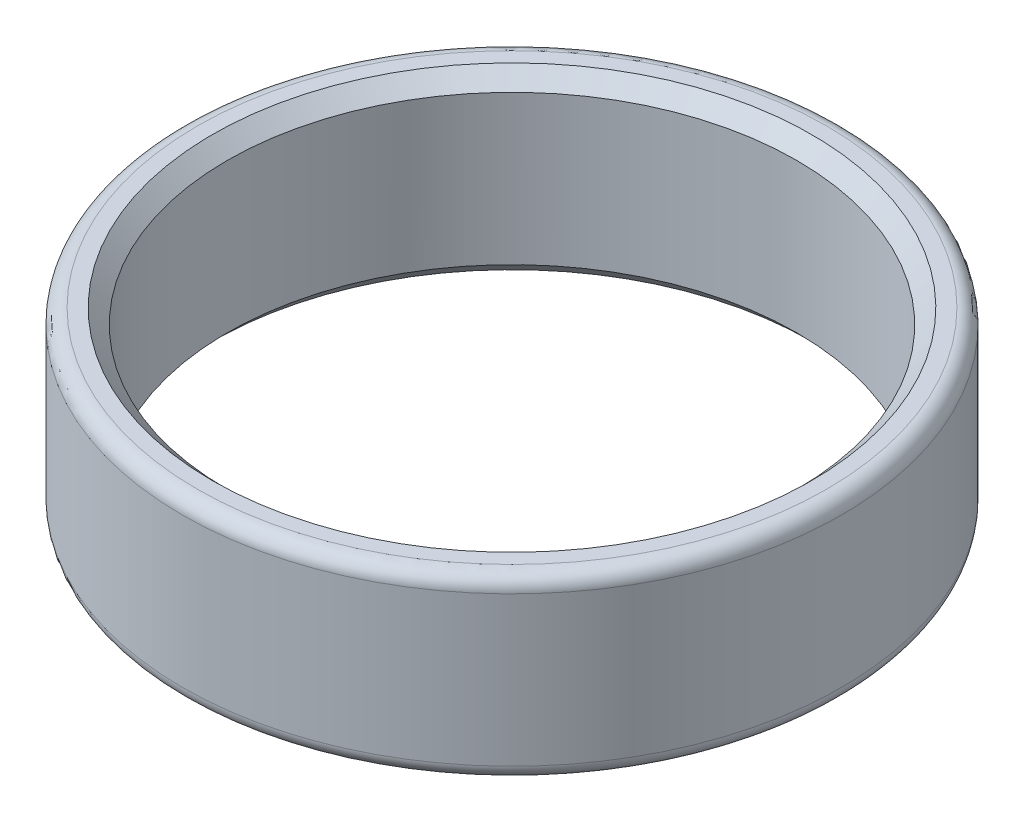
from build123d import *

# Parameters (mm, degrees)
SKETCH1_R           = 35.052
SKETCH1_R_2         = 30.2895
BOSS_EXTRUDE1_DEPTH = 19.05
FILLET1_R           = 1.5875
CHAMFER1_SIZE       = 1.5875


with BuildPart() as part:
    # Sketch1 → Boss-Extrude1 (new body)
    with BuildSketch(Plane(origin=(0, 0, 0), x_dir=(1, 0, 0), z_dir=(0, 1, 0))):
        with Locations(Location((0, 0, 0), (0, 0, 90))):
            Circle(SKETCH1_R)
        with Locations(Location((0, 0, 0), (0, 0, 90))):
            Circle(SKETCH1_R_2, mode=Mode.SUBTRACT)
    extrude(amount=BOSS_EXTRUDE1_DEPTH)

    # Fillet1
    fillet1_edges = [part.edges().sort_by_distance(p)[0] for p in [
        (0, 0, 35.052),
        (0, 19.05, 35.052),
    ]]
    fillet(fillet1_edges, radius=FILLET1_R)

    # Chamfer1
    chamfer1_edges = [part.edges().sort_by_distance(p)[0] for p in [
        (0, 0, 30.2895),
        (0, 19.05, 30.2895),
    ]]
    chamfer(chamfer1_edges, length=CHAMFER1_SIZE)


solid = part.part
